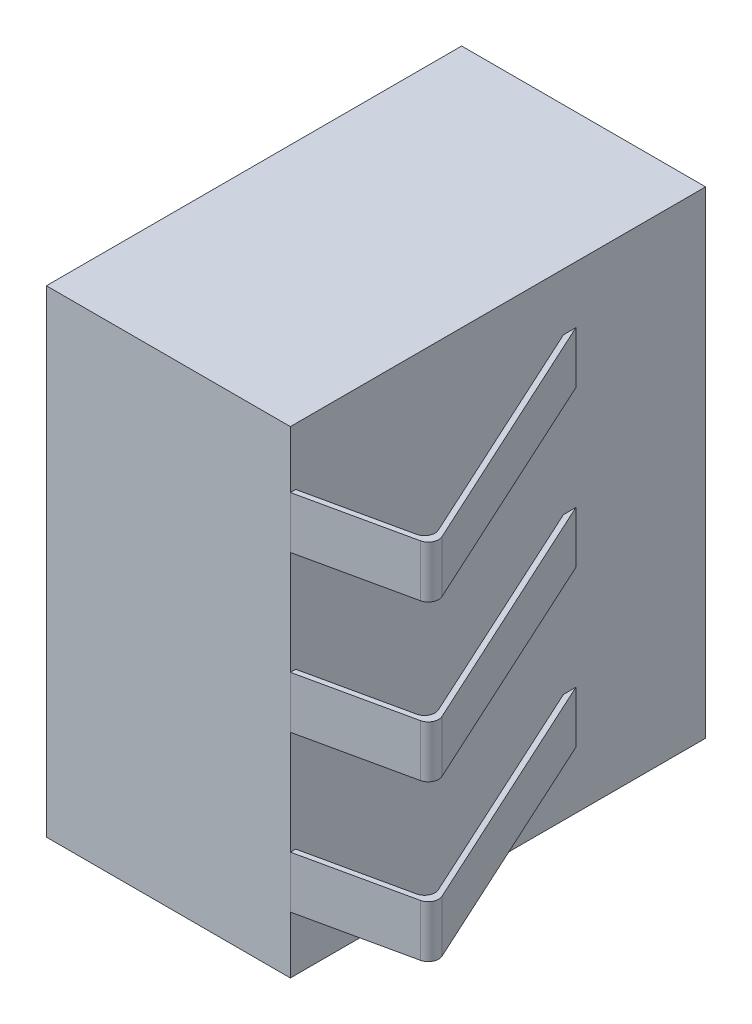
from build123d import *

# Parameters (mm, degrees)
SKETCH1_W                  = 4.7
SKETCH1_H                  = 9.2
BOSS_EXTRUDE1_DEPTH        = 8
BOSS_EXTRUDE2_DEPTH        = 0.5
FILLET1_R                  = 0.2
FILLET2_R                  = 0.2
LPATTERN2_COUNT            = 2
LPATTERN2_PITCH            = 3
FILLET1_OF_LPATTERN2_R     = 0.2
FILLET2_OF_LPATTERN2_R     = 0.2
LPATTERN2_COL_COUNT        = 2
LPATTERN2_COL_PITCH        = 3
FILLET1_OF_LPATTERN2_COL_R = 0.2
FILLET2_OF_LPATTERN2_COL_R = 0.2


with BuildPart() as part:
    # Sketch1 → Boss-Extrude1 (new body)
    with BuildSketch(Plane.XY):
        Rectangle(SKETCH1_W, SKETCH1_H)
    extrude(amount=BOSS_EXTRUDE1_DEPTH)

    # Sketch2 → Boss-Extrude2 (add, symmetric)
    with BuildSketch(Plane(origin=(0, 0, 0), x_dir=(1, 0, 0), z_dir=(0, 1, 0))):
        Polygon((2.35, -8), (4.65, -7.5), (2.35, -2.5), (2.35, -2.739288485), (4.507138989, -7.428721069), (2.35, -7.897664328), align=None)
    boss_extrude2 = extrude(amount=BOSS_EXTRUDE2_DEPTH, both=True)

    # Fillet1
    fillet1_edges = [part.edges().sort_by_distance(p)[0] for p in [
        (4.507138989, 0, 7.428721069),
    ]]
    fillet(fillet1_edges, radius=FILLET1_R)

    # Fillet2
    fillet2_edges = [part.edges().sort_by_distance(p)[0] for p in [
        (4.65, 0, 7.5),
    ]]
    fillet(fillet2_edges, radius=FILLET2_R)

    # LPattern2: Boss-Extrude2 ×2
    with Locations(*[(0, -i * LPATTERN2_PITCH, 0) for i in range(1, LPATTERN2_COUNT)]):
        add(boss_extrude2)

    # Fillet1 of LPattern2
    fillet1_of_lpattern2_edges = [part.edges().sort_by_distance(p)[0] for p in [
        (4.507138989, -3, 7.428721069),
    ]]
    fillet(fillet1_of_lpattern2_edges, radius=FILLET1_OF_LPATTERN2_R)

    # Fillet2 of LPattern2
    fillet2_of_lpattern2_edges = [part.edges().sort_by_distance(p)[0] for p in [
        (4.65, -3, 7.5),
    ]]
    fillet(fillet2_of_lpattern2_edges, radius=FILLET2_OF_LPATTERN2_R)

    # LPattern2 col: Boss-Extrude2 ×2
    with Locations(*[(0, i * LPATTERN2_COL_PITCH, 0) for i in range(1, LPATTERN2_COL_COUNT)]):
        add(boss_extrude2)

    # Fillet1 of LPattern2 col
    fillet1_of_lpattern2_col_edges = [part.edges().sort_by_distance(p)[0] for p in [
        (4.507138989, 3, 7.428721069),
    ]]
    fillet(fillet1_of_lpattern2_col_edges, radius=FILLET1_OF_LPATTERN2_COL_R)

    # Fillet2 of LPattern2 col
    fillet2_of_lpattern2_col_edges = [part.edges().sort_by_distance(p)[0] for p in [
        (4.65, 3, 7.5),
    ]]
    fillet(fillet2_of_lpattern2_col_edges, radius=FILLET2_OF_LPATTERN2_COL_R)


solid = part.part
